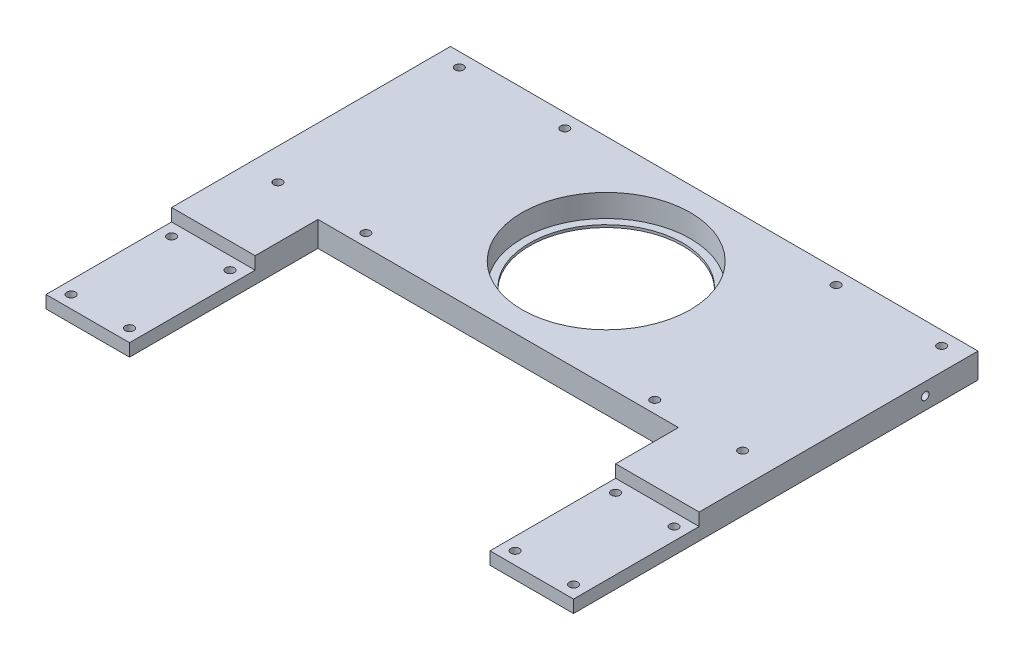
from build123d import *

# Parameters (mm, degrees)
SKIZZE1_W                        = 210
SKIZZE1_H                        = 400
AUFSATZ_LINEAR_AUSTRAGEN1_DEPTH  = 10
SKIZZE5_W                        = 210
SKIZZE5_H                        = 85
SCHNITT_LINEAR_AUSTRAGEN2_DEPTH  = 10
SKIZZE6_R                        = 1.7
SCHNITT_LINEAR_AUSTRAGEN3_DEPTH  = 227.108381092
SCHNITT_LINEAR_AUSTRAGEN4_DEPTH  = 4
SKIZZE16_W                       = 35
SKIZZE16_H                       = 7
SCHNITT_LINEAR_AUSTRAGEN10_DEPTH = 5
SCHNITT_LINEAR_AUSTRAGEN11_DEPTH = 35
SKIZZE20_R                       = 1.7
SCHNITT_LINEAR_AUSTRAGEN12_DEPTH = 227.108381092
SKIZZE21_W                       = 143.493506494
SKIZZE21_H                       = 75
SCHNITT_LINEAR_AUSTRAGEN13_DEPTH = 227.108381092
SCHNITT_LINEAR_AUSTRAGEN14_DEPTH = 227.108381092
AUFSATZ_LINEAR_AUSTRAGEN6_DEPTH  = 10
SKIZZE25_R                       = 1.7
SCHNITT_LINEAR_AUSTRAGEN15_DEPTH = 227.108381092
SCHNITT_LINEAR_AUSTRAGEN16_DEPTH = 291.172362571
SKIZZE27_R                       = 33.5
SCHNITT_LINEAR_AUSTRAGEN17_DEPTH = 157.044865343
SKIZZE28_R                       = 36.006256149
SKIZZE28_R_2                     = 30.5
AUFSATZ_LINEAR_AUSTRAGEN7_DEPTH  = 1
SKIZZE29_R                       = 1.5
SCHNITT_LINEAR_AUSTRAGEN18_DEPTH = 10
SKIZZE30_R                       = 1.5
SCHNITT_LINEAR_AUSTRAGEN19_DEPTH = 10
SKIZZE31_R                       = 2.95
SCHNITT_LINEAR_AUSTRAGEN20_DEPTH = 3.5


with BuildPart() as part:
    # Skizze1 → Aufsatz-Linear austragen1 (new body)
    with BuildSketch(Plane(origin=(0, 0, 0), x_dir=(1, 0, 0), z_dir=(0, 1, 0))):
        Rectangle(SKIZZE1_W, SKIZZE1_H)
    extrude(amount=AUFSATZ_LINEAR_AUSTRAGEN1_DEPTH)

    # Skizze5 → Schnitt-Linear austragen2 (cut)
    with BuildSketch(Plane(origin=(0, 10, 0), x_dir=(1, 0, 0), z_dir=(0, 1, 0))):
        Polygon((105, -200), (18, -200), (105, -46), align=None)
        Polygon((-18, -200), (-105, -46), (-105, -200), align=None)
        with Locations((0, 157.5)):
            Rectangle(SKIZZE5_W, SKIZZE5_H)
        Polygon((71.746753247, -46), (-71.746753247, -46), (-2.824675325, -168), (2.824675325, -168), align=None)
    extrude(amount=-SCHNITT_LINEAR_AUSTRAGEN2_DEPTH, mode=Mode.SUBTRACT)

    # Skizze6 → Schnitt-Linear austragen3 (cut, through all)
    with BuildSketch(Plane(origin=(0, 10, 0), x_dir=(1, 0, 0), z_dir=(0, 1, 0))):
        with Locations(Location((-11, -195, 0), (0, 0, 270))):
            Circle(SKIZZE6_R)
        with Locations(Location((-11, -178.18, 0), (0, 0, 90))):
            Circle(SKIZZE6_R)
        with Locations(Location((11, -195, 0), (0, 0, 90))):
            Circle(SKIZZE6_R)
        with Locations(Location((11, -178.18, 0), (0, 0, 270))):
            Circle(SKIZZE6_R)
    extrude(amount=-SCHNITT_LINEAR_AUSTRAGEN3_DEPTH, mode=Mode.SUBTRACT)

    # Skizze7 → Schnitt-Linear austragen4 (cut)
    with BuildSketch(Plane.XZ):
        Polygon((-11, 198.406366588), (-8.05, 196.703183294), (-8.05, 193.296816706), (-11, 191.593633412), (-13.95, 193.296816706), (-13.95, 196.703183294), align=None)
        Polygon((11, 198.406366588), (8.05, 196.703183294), (8.05, 193.296816706), (11, 191.593633412), (13.95, 193.296816706), (13.95, 196.703183294), align=None)
        Polygon((-8.05, 176.476816706), (-8.05, 179.883183294), (-11, 181.586366588), (-13.95, 179.883183294), (-13.95, 176.476816706), (-11, 174.773633412), align=None)
        Polygon((8.05, 176.476816706), (8.05, 179.883183294), (11, 181.586366588), (13.95, 179.883183294), (13.95, 176.476816706), (11, 174.773633412), align=None)
    extrude(amount=-SCHNITT_LINEAR_AUSTRAGEN4_DEPTH, mode=Mode.SUBTRACT)

    # Skizze16 → Schnitt-Linear austragen10 (cut)
    with BuildSketch(Plane.XZ):
        with Locations((0, 186.59)):
            Rectangle(SKIZZE16_W, SKIZZE16_H)
    extrude(amount=-SCHNITT_LINEAR_AUSTRAGEN10_DEPTH, mode=Mode.SUBTRACT)

    # Skizze17 → Schnitt-Linear austragen11 (cut)
    with BuildSketch(Plane.ZY.offset(-17.5)):
        Polygon((183.09, 5), (186.59, 8.5), (190.09, 5), align=None)
    extrude(amount=SCHNITT_LINEAR_AUSTRAGEN11_DEPTH, mode=Mode.SUBTRACT)

    # Skizze20 → Schnitt-Linear austragen12 (cut, through all)
    with BuildSketch(Plane(origin=(0, 10, 0), x_dir=(1, 0, 0), z_dir=(0, 1, 0))):
        with Locations(Location((96, 109.52, 0), (0, 0, 270))):
            Circle(SKIZZE20_R)
        with Locations(Location((54, 109.52, 0), (0, 0, 270))):
            Circle(SKIZZE20_R)
        with Locations(Location((-54, 109.52, 0), (0, 0, 90))):
            Circle(SKIZZE20_R)
        with Locations(Location((-96, 109.52, 0), (0, 0, 90))):
            Circle(SKIZZE20_R)
        with Locations(Location((92.5, 33.82, 0), (0, 0, 270))):
            Circle(SKIZZE20_R)
        with Locations(Location((57.5, 33.82, 0), (0, 0, 270))):
            Circle(SKIZZE20_R)
        with Locations(Location((-92.5, 33.82, 0), (0, 0, 90))):
            Circle(SKIZZE20_R)
        with Locations(Location((-57.5, 33.82, 0), (0, 0, 90))):
            Circle(SKIZZE20_R)
    extrude(amount=-SCHNITT_LINEAR_AUSTRAGEN12_DEPTH, mode=Mode.SUBTRACT)

    # Skizze21 → Schnitt-Linear austragen13 (cut, through all)
    with BuildSketch(Plane(origin=(0, 10, 0), x_dir=(1, 0, 0), z_dir=(0, 1, 0))):
        with Locations((0, -8.5)):
            Rectangle(SKIZZE21_W, SKIZZE21_H)
    extrude(amount=-SCHNITT_LINEAR_AUSTRAGEN13_DEPTH, mode=Mode.SUBTRACT)

    # Skizze22 → Schnitt-Linear austragen14 (cut, through all)
    with BuildSketch(Plane(origin=(0, 10, 0), x_dir=(1, 0, 0), z_dir=(0, 1, 0))):
        with BuildLine():
            Line((-71.746753247, -46), (-2.824675325, -168))
            ThreePointArc((-2.824675325, -168), (-55.506711033, -117.293679981), (-71.746753247, -46))
        make_face()
    schnitt_linear_austragen14 = extrude(amount=-SCHNITT_LINEAR_AUSTRAGEN14_DEPTH, mode=Mode.SUBTRACT)

    # Skizze23 → Aufsatz-Linear austragen6 (add)
    with BuildSketch(Plane(origin=(0, 10, 0), x_dir=(1, 0, 0), z_dir=(0, 1, 0))):
        with BuildLine():
            Line((-105, -46), (-18, -200))
            ThreePointArc((-18, -200), (-78.088357737, -132.371344955), (-105, -46))
        make_face()
    aufsatz_linear_austragen6 = extrude(amount=-AUFSATZ_LINEAR_AUSTRAGEN6_DEPTH)

    # Spiegeln2: Schnitt-Linear austragen14, Aufsatz-Linear austragen6 across plane
    add(schnitt_linear_austragen14.mirror(Plane(origin=(0, 0, 0), x_dir=(0, 0, 1), z_dir=(1, 0, 0))), mode=Mode.SUBTRACT)
    add(aufsatz_linear_austragen6.mirror(Plane(origin=(0, 0, 0), x_dir=(0, 0, 1), z_dir=(1, 0, 0))))

    # Skizze25 → Schnitt-Linear austragen15 (cut, through all)
    with BuildSketch(Plane(origin=(0, 10, 0), x_dir=(1, 0, 0), z_dir=(0, 1, 0))):
        with Locations(Location((-100, -1, 0), (0, 0, 270))):
            Circle(SKIZZE25_R)
        with Locations(Location((-76.746753247, -1, 0), (0, 0, 90))):
            Circle(SKIZZE25_R)
        with Locations(Location((-76.746753247, -41, 0), (0, 0, 270))):
            Circle(SKIZZE25_R)
        with Locations(Location((-100, -41, 0), (0, 0, 90))):
            Circle(SKIZZE25_R)
    schnitt_linear_austragen15 = extrude(amount=-SCHNITT_LINEAR_AUSTRAGEN15_DEPTH, mode=Mode.SUBTRACT)

    # Spiegeln3: Schnitt-Linear austragen15 across plane
    add(schnitt_linear_austragen15.mirror(Plane(origin=(0, 0, 0), x_dir=(0, 0, 1), z_dir=(1, 0, 0))), mode=Mode.SUBTRACT)

    # Skizze26 → Schnitt-Linear austragen16 (cut, through all)
    with BuildSketch(Plane.ZY.offset(105)):
        Polygon((-4, 5), (-4, 13.101486595), (200.684563047, 82.546277137), (242.997216492, -41.037631402), (91.241487897, -60.284782055), (46, 0), (46, 5), align=None)
    extrude(amount=-SCHNITT_LINEAR_AUSTRAGEN16_DEPTH, mode=Mode.SUBTRACT)

    # Skizze27 → Schnitt-Linear austragen17 (cut, through all)
    with BuildSketch(Plane(origin=(0, 10, 0), x_dir=(1, 0, 0), z_dir=(0, 1, 0))):
        with Locations(Location((0, 72, 0), (0, 0, 270))):
            Circle(SKIZZE27_R)
    extrude(amount=-SCHNITT_LINEAR_AUSTRAGEN17_DEPTH, mode=Mode.SUBTRACT)

    # Skizze28 → Aufsatz-Linear austragen7 (add)
    with BuildSketch(Plane.XZ):
        with Locations((0, -72)):
            Circle(SKIZZE28_R)
        with Locations(Location((0, -72, 0), (0, 0, 270))):
            Circle(SKIZZE28_R_2, mode=Mode.SUBTRACT)
    extrude(amount=-AUFSATZ_LINEAR_AUSTRAGEN7_DEPTH)

    # Skizze29 → Schnitt-Linear austragen18 (cut)
    with BuildSketch(Plane.ZY.offset(105)):
        with Locations((-94, 5)):
            Circle(SKIZZE29_R)
    schnitt_linear_austragen18 = extrude(amount=-SCHNITT_LINEAR_AUSTRAGEN18_DEPTH, mode=Mode.SUBTRACT)

    # Skizze30 → Schnitt-Linear austragen19 (cut)
    with BuildSketch(Plane(origin=(0, 0, -115), x_dir=(-1, 0, 0), z_dir=(0, 0, -1))):
        with Locations((100, 5)):
            Circle(SKIZZE30_R)
        with Locations((84, 5)):
            Circle(SKIZZE30_R)
    schnitt_linear_austragen19 = extrude(amount=-SCHNITT_LINEAR_AUSTRAGEN19_DEPTH, mode=Mode.SUBTRACT)

    # Spiegeln4: Schnitt-Linear austragen18, Schnitt-Linear austragen19 across plane
    add(schnitt_linear_austragen18.mirror(Plane(origin=(0, 0, 0), x_dir=(0, 0, 1), z_dir=(1, 0, 0))), mode=Mode.SUBTRACT)
    add(schnitt_linear_austragen19.mirror(Plane(origin=(0, 0, 0), x_dir=(0, 0, 1), z_dir=(1, 0, 0))), mode=Mode.SUBTRACT)

    # Skizze31 → Schnitt-Linear austragen20 (cut)
    with BuildSketch(Plane.XZ):
        with Locations(Location((-96, -109.52, 0), (0, 0, 270))):
            Circle(SKIZZE31_R)
        with Locations(Location((-54, -109.52, 0), (0, 0, 270))):
            Circle(SKIZZE31_R)
        with Locations(Location((-92.5, -33.82, 0), (0, 0, 270))):
            Circle(SKIZZE31_R)
        with Locations(Location((-57.5, -33.82, 0), (0, 0, 270))):
            Circle(SKIZZE31_R)
        with Locations(Location((57.5, -33.82, 0), (0, 0, 90))):
            Circle(SKIZZE31_R)
        with Locations(Location((92.5, -33.82, 0), (0, 0, 90))):
            Circle(SKIZZE31_R)
        with Locations(Location((54, -109.52, 0), (0, 0, 90))):
            Circle(SKIZZE31_R)
        with Locations(Location((96, -109.52, 0), (0, 0, 90))):
            Circle(SKIZZE31_R)
    extrude(amount=-SCHNITT_LINEAR_AUSTRAGEN20_DEPTH, mode=Mode.SUBTRACT)


solid = part.part
